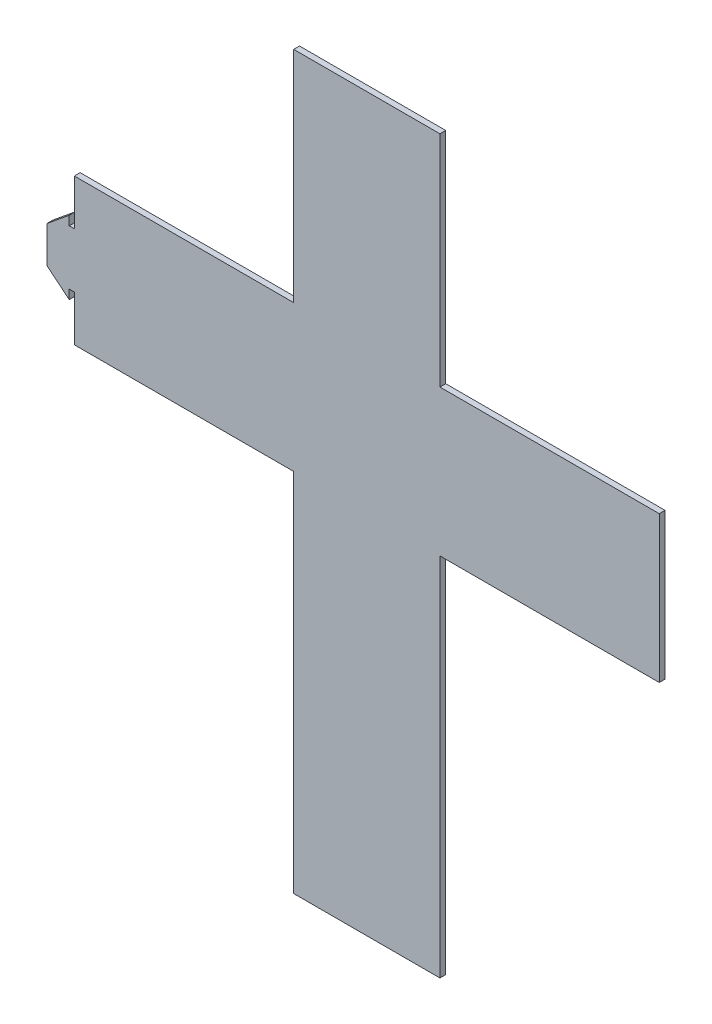
from build123d import *

# Parameters (mm, degrees)
BOSS_EXTRUDE1_DEPTH = 1.5875
BOSS_EXTRUDE2_DEPTH = 1.5875


with BuildPart() as part:
    # Sketch1 → Boss-Extrude1 (new body)
    with BuildSketch(Plane.XY):
        Polygon((-20, 20), (-20, 80), (20, 80), (20, 20), (80, 20), (80, -20), (20, -20), (20, -120), (-20, -120), (-20, -20), (-80, -20), (-80, 20), align=None)
    extrude(amount=BOSS_EXTRUDE1_DEPTH)

    # Sketch13 → Boss-Extrude2 (add)
    with BuildSketch(Plane.XY):
        Polygon((-80, 7.5), (-80, -7.5), (-81.4, -7.5), (-81.4, -10), (-87.5, -5), (-87.5, 5), (-81.4, 10), (-81.4, 7.5), align=None)
    extrude(amount=BOSS_EXTRUDE2_DEPTH)


solid = part.part
